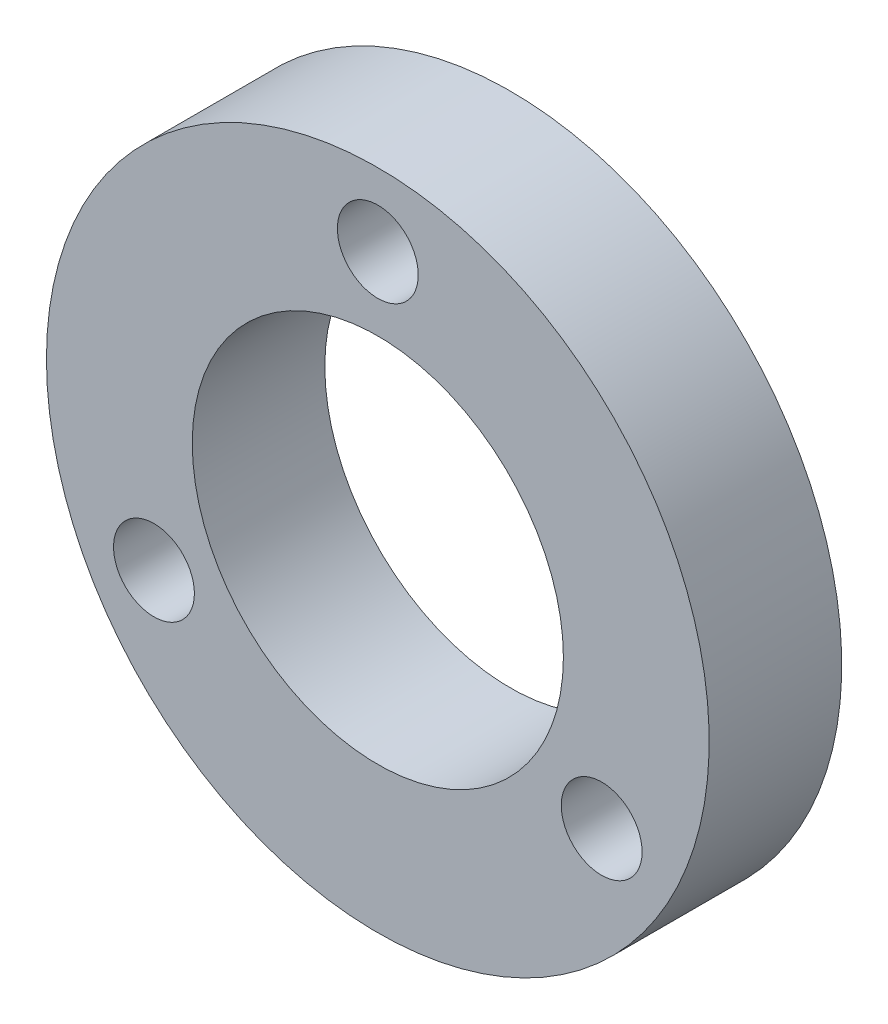
from build123d import *

# Parameters (mm, degrees)
SKETCH1_R           = 12.5
SKETCH1_R_2         = 7
BOSS_EXTRUDE1_DEPTH = 5
CUT_EXTRUDE1_REACH  = 20.371
SKETCH2_R           = 1.525


with BuildPart() as part:
    # Sketch1 → Boss-Extrude1 (new body)
    with BuildSketch(Plane.XY):
        Circle(SKETCH1_R)
        Circle(SKETCH1_R_2, mode=Mode.SUBTRACT)
    extrude(amount=BOSS_EXTRUDE1_DEPTH)

    # Sketch2 → Cut-Extrude1 (cut, up to next)
    with BuildSketch(Plane.XY.offset(5), mode=Mode.PRIVATE) as cut_extrude1_sk1:
        with Locations((0, 9.75)):
            Circle(SKETCH2_R)
    cut_extrude1_tool1 = extrude(cut_extrude1_sk1.sketch, amount=-CUT_EXTRUDE1_REACH, mode=Mode.PRIVATE) & part.part
    # Sketch2 → Cut-Extrude1 (cut, up to next)
    with BuildSketch(Plane.XY.offset(5), mode=Mode.PRIVATE) as cut_extrude1_sk2:
        with Locations((8.443747687, -4.875)):
            Circle(SKETCH2_R)
    cut_extrude1_tool2 = extrude(cut_extrude1_sk2.sketch, amount=-CUT_EXTRUDE1_REACH, mode=Mode.PRIVATE) & part.part
    # Sketch2 → Cut-Extrude1 (cut, up to next)
    with BuildSketch(Plane.XY.offset(5), mode=Mode.PRIVATE) as cut_extrude1_sk3:
        with Locations((-8.443747687, -4.875)):
            Circle(SKETCH2_R)
    cut_extrude1_tool3 = extrude(cut_extrude1_sk3.sketch, amount=-CUT_EXTRUDE1_REACH, mode=Mode.PRIVATE) & part.part
    add(cut_extrude1_tool1.solids().sort_by_distance((0, 9.75, 5))[0], mode=Mode.SUBTRACT)
    add(cut_extrude1_tool2.solids().sort_by_distance((8.443748, -4.875, 5))[0], mode=Mode.SUBTRACT)
    add(cut_extrude1_tool3.solids().sort_by_distance((-8.443748, -4.875, 5))[0], mode=Mode.SUBTRACT)


solid = part.part
